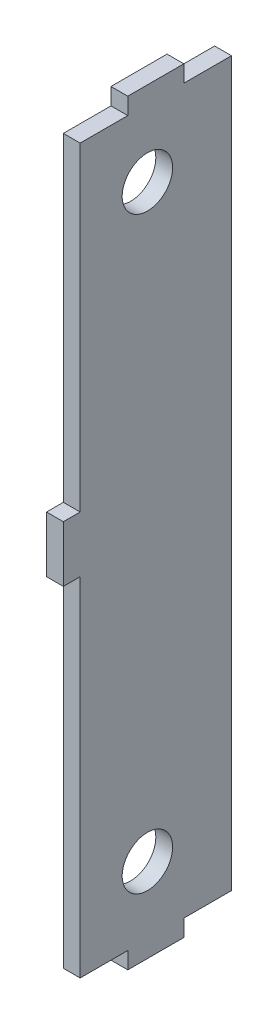
from build123d import *

# Parameters (mm, degrees)
BOSS_EXTRUDE1_DEPTH = 3
SKETCH2_R           = 4.5
CUT_EXTRUDE1_DEPTH  = 74.927329182


with BuildPart() as part:
    # Sketch1 → Boss-Extrude1 (new body)
    with BuildSketch(Plane(origin=(0, 0, 0), x_dir=(0, 0, -1), z_dir=(1, 0, 0))):
        Polygon((0, 64.5), (-8.5, 64.5), (-8.5, 67.5), (-18.5, 67.5), (-18.5, 64.5), (-27, 64.5), (-27, 7.5), (-30, 7.5), (-30, -2.5), (-27, -2.5), (-27, -64.5), (-18.5, -64.5), (-18.5, -67.5), (-8.5, -67.5), (-8.5, -64.5), (0, -64.5), align=None)
    extrude(amount=BOSS_EXTRUDE1_DEPTH)

    # Sketch2 → Cut-Extrude1 (cut, through all)
    with BuildSketch(Plane(origin=(3, 0, 0), x_dir=(0, 0, -1), z_dir=(1, 0, 0))):
        with Locations((-15, 52.5)):
            Circle(SKETCH2_R)
        with Locations((-15, -52.5)):
            Circle(SKETCH2_R)
    extrude(amount=-CUT_EXTRUDE1_DEPTH, mode=Mode.SUBTRACT)


solid = part.part
